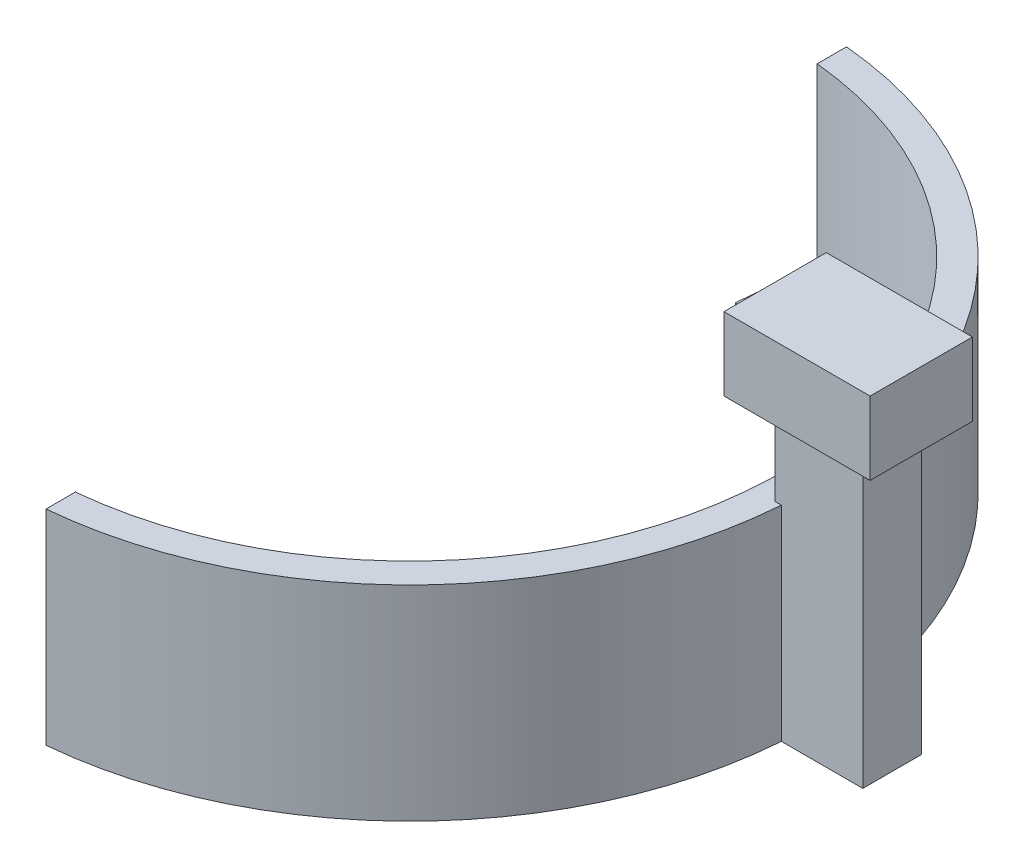
from build123d import *

# Parameters (mm, degrees)
BOSS_EXTRUDE1_DEPTH = 12
BOSS_EXTRUDE2_START = -2
BOSS_EXTRUDE2_DEPTH = 2
SKETCH4_W           = 6
SKETCH4_H           = 4
BOSS_EXTRUDE3_DEPTH = 20
SKETCH5_W           = 10
SKETCH5_H           = 7
BOSS_EXTRUDE4_DEPTH = 5


with BuildPart() as part:
    # Sketch1 → Boss-Extrude1 (new body)
    with BuildSketch(Plane(origin=(0, 0, 0), x_dir=(1, 0, 0), z_dir=(0, 1, 0))):
        with BuildLine():
            Line((2.5, 27.386127875), (2.5, 25.377155081))
            ThreePointArc((2.5, 25.377155081), (25.5, 0), (2.5, -25.377155081))
            Line((2.5, -25.377155081), (2.5, -27.386127875))
            ThreePointArc((2.5, -27.386127875), (27.5, 0), (2.5, 27.386127875))
        make_face()
    extrude(amount=BOSS_EXTRUDE1_DEPTH)

    # Sketch2 → Boss-Extrude2 (add)
    with BuildSketch(Plane(origin=(0, 0, 0), x_dir=(1, 0, 0), z_dir=(0, 1, 0)).offset(BOSS_EXTRUDE2_START)):
        with BuildLine():
            Line((2.5, 27.386127875), (1.863636364, 20.415113507))
            ThreePointArc((1.863636364, 20.415113507), (20.5, 0), (1.863636364, -20.415113507))
            Line((1.863636364, -20.415113507), (2.5, -27.386127875))
            ThreePointArc((2.5, -27.386127875), (27.5, 0), (2.5, 27.386127875))
        make_face()
    extrude(amount=BOSS_EXTRUDE2_DEPTH)

    # Sketch4 → Boss-Extrude3 (add)
    with BuildSketch(Plane(origin=(0, -2, 0), x_dir=(1, 0, 0), z_dir=(0, 1, 0))):
        with Locations((30, 0)):
            Rectangle(SKETCH4_W, SKETCH4_H)
    extrude(amount=BOSS_EXTRUDE3_DEPTH)

    # Sketch5 → Boss-Extrude4 (add)
    with BuildSketch(Plane(origin=(0, 18, 0), x_dir=(1, 0, 0), z_dir=(0, 1, 0))):
        with Locations((30, 0)):
            Rectangle(SKETCH5_W, SKETCH5_H)
    extrude(amount=BOSS_EXTRUDE4_DEPTH)


solid = part.part
